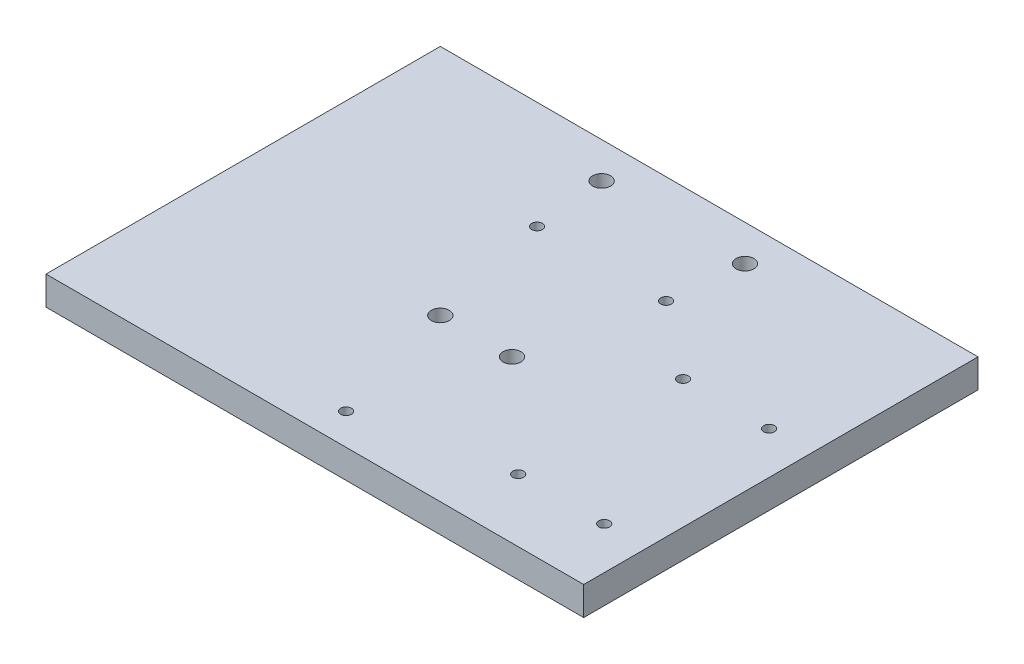
from build123d import *

# Parameters (mm, degrees)
SKETCH1_W           = 150
SKETCH1_H           = 110
SKETCH1_R           = 2.5
BOSS_EXTRUDE1_DEPTH = 8
SKETCH3_R           = 1.5
CUT_EXTRUDE1_DEPTH  = 8
SKETCH4_R           = 1.5
CUT_EXTRUDE2_DEPTH  = 8
SKETCH5_W           = 10
SKETCH5_H           = 10
CUT_EXTRUDE3_DEPTH  = 3


with BuildPart() as part:
    # Sketch1 → Boss-Extrude1 (new body)
    with BuildSketch(Plane(origin=(0, 0, 0), x_dir=(1, 0, 0), z_dir=(0, 1, 0))):
        with Locations((0, -55)):
            Rectangle(SKETCH1_W, SKETCH1_H)
        with Locations(Location((-10, -65, 0), (0, 0, 270))):
            Circle(SKETCH1_R, mode=Mode.SUBTRACT)
        with Locations(Location((10, -65, 0), (0, 0, 270))):
            Circle(SKETCH1_R, mode=Mode.SUBTRACT)
        with Locations(Location((-20, -10, 0), (0, 0, 270))):
            Circle(SKETCH1_R, mode=Mode.SUBTRACT)
        with Locations(Location((20, -10, 0), (0, 0, 90))):
            Circle(SKETCH1_R, mode=Mode.SUBTRACT)
    extrude(amount=BOSS_EXTRUDE1_DEPTH)

    # Sketch3 → Cut-Extrude1 (cut)
    with BuildSketch(Plane(origin=(0, 8, 0), x_dir=(1, 0, 0), z_dir=(0, 1, 0))):
        with Locations(Location((-18, -30, 0), (0, 0, 270))):
            Circle(SKETCH3_R)
        with Locations(Location((18, -30, 0), (0, 0, 90))):
            Circle(SKETCH3_R)
        with Locations(Location((0, -101.3, 0), (0, 0, 270))):
            Circle(SKETCH3_R)
    extrude(amount=-CUT_EXTRUDE1_DEPTH, mode=Mode.SUBTRACT)

    # Sketch4 → Cut-Extrude2 (cut)
    with BuildSketch(Plane(origin=(0, 8, 0), x_dir=(1, 0, 0), z_dir=(0, 1, 0))):
        with Locations(Location((39.215686275, -46.492464754, 0), (0, 0, 270))):
            Circle(SKETCH4_R)
        with Locations(Location((63.215686275, -46.492464754, 0), (0, 0, 270))):
            Circle(SKETCH4_R)
        with Locations(Location((39.215686275, -92.492464754, 0), (0, 0, 270))):
            Circle(SKETCH4_R)
        with Locations(Location((63.215686275, -92.492464754, 0), (0, 0, 270))):
            Circle(SKETCH4_R)
    extrude(amount=-CUT_EXTRUDE2_DEPTH, mode=Mode.SUBTRACT)

    # Sketch5 → Cut-Extrude3 (cut)
    with BuildSketch(Plane.XZ):
        with Locations((0, 101.3)):
            Rectangle(SKETCH5_W, SKETCH5_H)
        with Locations((39.215686275, 92.492464754)):
            Rectangle(SKETCH5_W, SKETCH5_H)
        with Locations((63.215686275, 92.492464754)):
            Rectangle(SKETCH5_W, SKETCH5_H)
        with Locations((63.215686275, 46.492464754)):
            Rectangle(SKETCH5_W, SKETCH5_H)
        with Locations((39.215686275, 46.492464754)):
            Rectangle(SKETCH5_W, SKETCH5_H)
        with Locations((-18, 30)):
            Rectangle(SKETCH5_W, SKETCH5_H)
        with Locations((18, 30)):
            Rectangle(SKETCH5_W, SKETCH5_H)
    extrude(amount=-CUT_EXTRUDE3_DEPTH, mode=Mode.SUBTRACT)


solid = part.part
